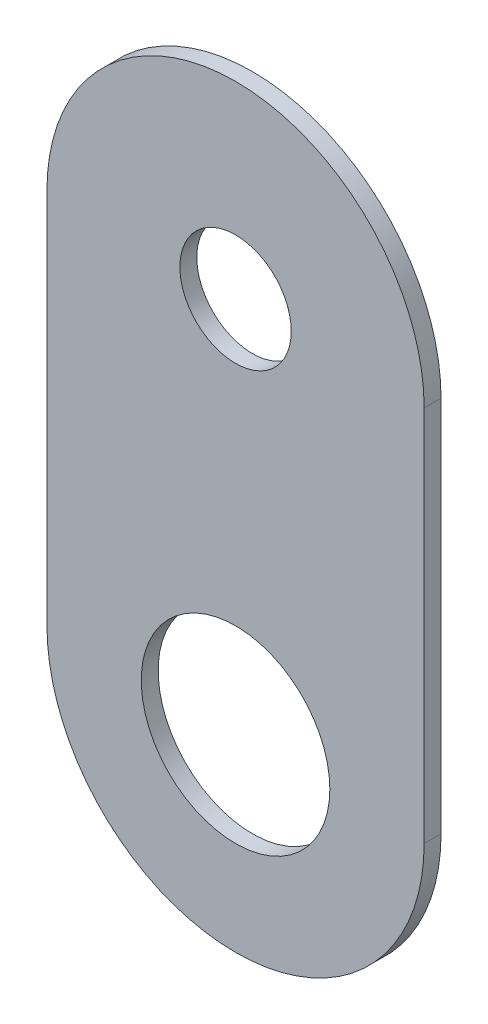
from build123d import *

# Parameters (mm, degrees)
BOSS_EXTRUDE1_DEPTH = 2.276130482


with BuildPart() as part:
    # Sketch1 → Boss-Extrude1 (new body)
    with BuildSketch(Plane.XY):
        with BuildLine():
            ThreePointArc((-7.498149452, 0), (0, 7.498149452), (7.498149452, 0))
            Line((7.498149452, 0), (25.4, 0))
            ThreePointArc((25.4, 0), (0, 25.4), (-25.4, 0))
            Line((-25.4, 0), (-7.498149452, 0))
        make_face()
        with BuildLine():
            Line((25.4, 0), (7.498149452, 0))
            ThreePointArc((7.498149452, 0), (0, -7.498149452), (-7.498149452, 0))
            Line((-7.498149452, 0), (-25.4, 0))
            ThreePointArc((-25.4, 0), (-17.960512225, -17.960512259), (4.9e-08, -25.4))
            ThreePointArc((4.9e-08, -25.4), (17.960512259, -17.960512225), (25.4, 0))
        make_face()
        with BuildLine():
            Line((25.4, -50.8), (25.4, 0))
            ThreePointArc((25.4, 0), (17.960512259, -17.960512225), (4.9e-08, -25.4))
            ThreePointArc((4.9e-08, -25.4), (17.960512259, -32.839487775), (25.4, -50.8))
        make_face()
        with BuildLine():
            ThreePointArc((4.9e-08, -25.4), (-17.960512225, -17.960512259), (-25.4, 0))
            Line((-25.4, 0), (-25.4, -50.8))
            ThreePointArc((-25.4, -50.8), (-17.960512225, -32.839487741), (4.9e-08, -25.4))
        make_face()
        with BuildLine():
            ThreePointArc((-25.4, -50.8), (0, -76.2), (25.4, -50.8))
            Line((25.4, -50.8), (12.7, -50.8))
            ThreePointArc((12.7, -50.8), (0, -63.5), (-12.7, -50.8))
            Line((-12.7, -50.8), (-25.4, -50.8))
        make_face()
        with BuildLine():
            Line((12.7, -50.8), (25.4, -50.8))
            ThreePointArc((25.4, -50.8), (17.960512259, -32.839487775), (4.9e-08, -25.4))
            ThreePointArc((4.9e-08, -25.4), (-17.960512225, -32.839487741), (-25.4, -50.8))
            Line((-25.4, -50.8), (-12.7, -50.8))
            ThreePointArc((-12.7, -50.8), (0, -38.1), (12.7, -50.8))
        make_face()
    extrude(amount=BOSS_EXTRUDE1_DEPTH)


solid = part.part
